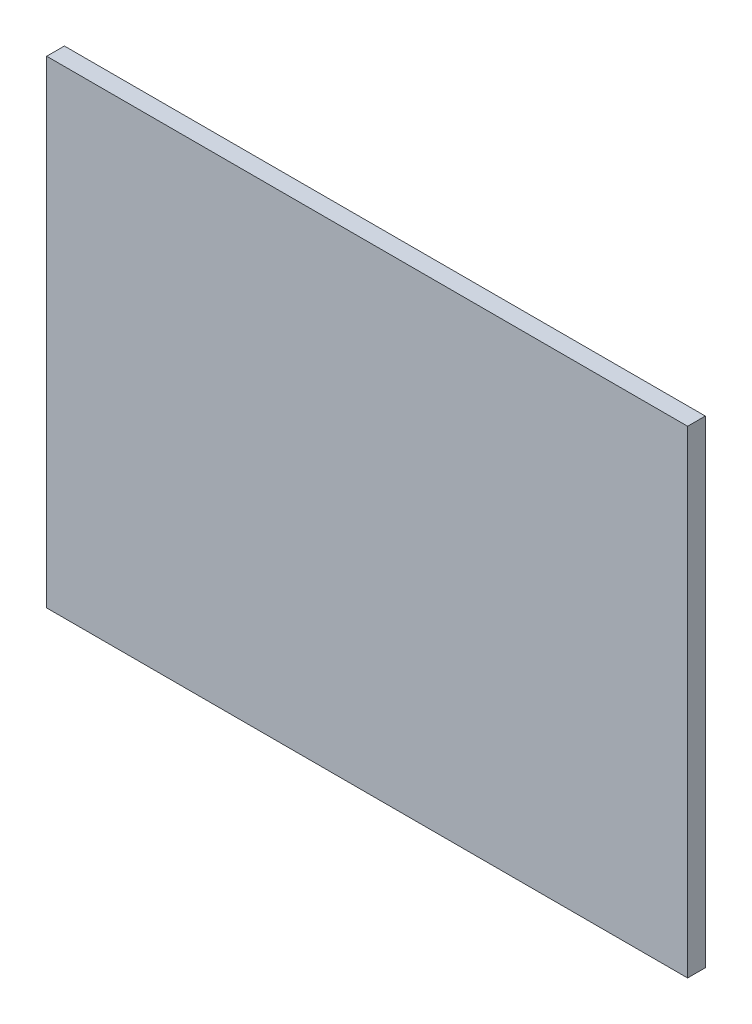
from build123d import *

# Parameters (mm, degrees)
SKETCH1_W           = 229.969358589
SKETCH1_H           = 171.45
BOSS_EXTRUDE1_DEPTH = 6.35


with BuildPart() as part:
    # Sketch1 → Boss-Extrude1 (new body)
    with BuildSketch(Plane.XY):
        with Locations((-24.365205383, 69.85)):
            Rectangle(SKETCH1_W, SKETCH1_H)
    extrude(amount=BOSS_EXTRUDE1_DEPTH)


solid = part.part
